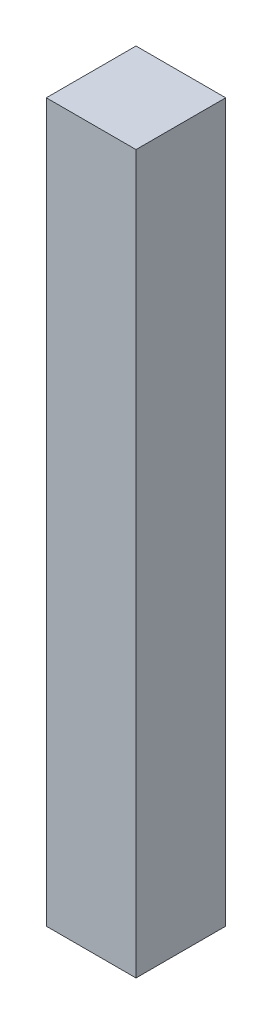
from build123d import *

# Parameters (mm, degrees)
CROQUIS2_W              = 5
CROQUIS2_H              = 40
SALIENTE_EXTRUIR1_DEPTH = 5


with BuildPart() as part:
    # Croquis2 → Saliente-Extruir1 (new body)
    with BuildSketch(Plane.XY):
        with Locations((2.5, 20)):
            Rectangle(CROQUIS2_W, CROQUIS2_H)
    extrude(amount=SALIENTE_EXTRUIR1_DEPTH)


solid = part.part
